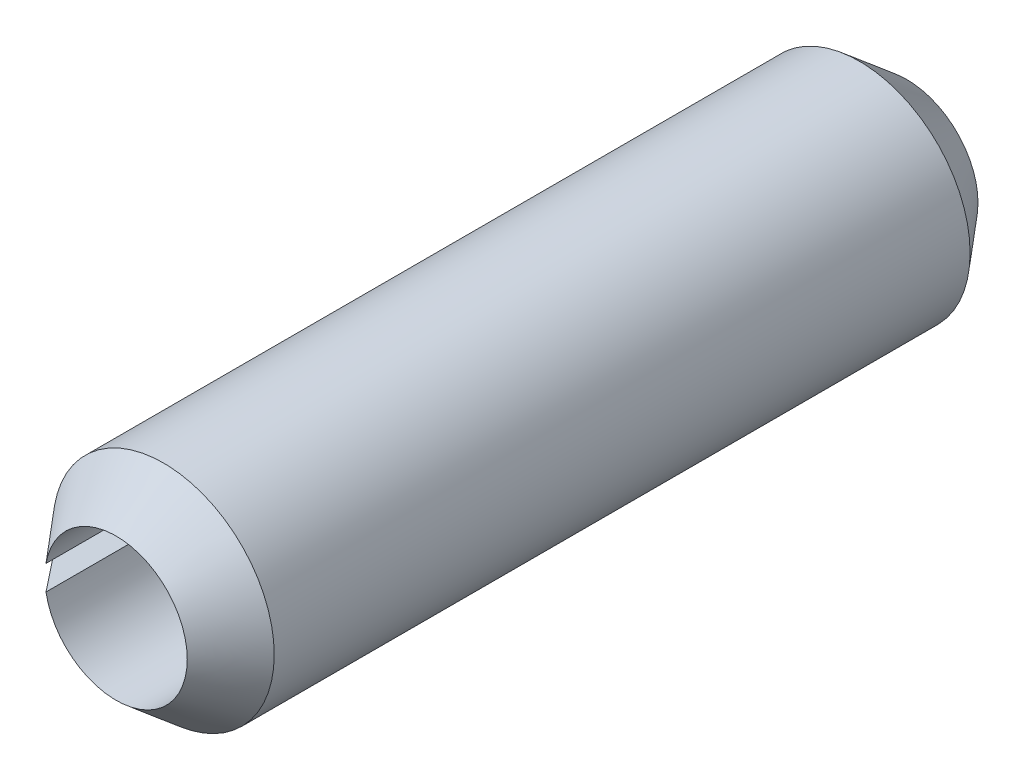
from build123d import *

# Parameters (mm, degrees)
EXTRUDE1_DEPTH = 5


with BuildPart() as part:
    # Sketch1 → Extrude1 (new, symmetric)
    with BuildSketch(Plane.XY):
        with BuildLine():
            Line((-1.378730854, 0.243107449), (-0.886326978, 0.15628336))
            ThreePointArc((-0.886326978, 0.15628336), (0.9, 0), (-0.886326978, -0.15628336))
            Line((-0.886326978, -0.15628336), (-1.378730854, -0.243107449))
            ThreePointArc((-1.378730854, -0.243107449), (1.4, 0), (-1.378730854, 0.243107449))
        make_face()
    extrude(amount=EXTRUDE1_DEPTH, both=True)

    # Sketch2 → Cut-Revolve1 (revolve, cut)
    with BuildSketch(Plane(origin=(0, 0, 0), x_dir=(0, 0, -1), z_dir=(1, 0, 0))):
        Polygon((5, 1.4), (5, 0.9), (4.4, 1.4), align=None)
        Polygon((-4.4, 1.4), (-5, 1.4), (-5, 0.9), align=None)
    revolve(axis=Axis((0, 0, -5), (0, 0, 1)), mode=Mode.SUBTRACT)


solid = part.part
